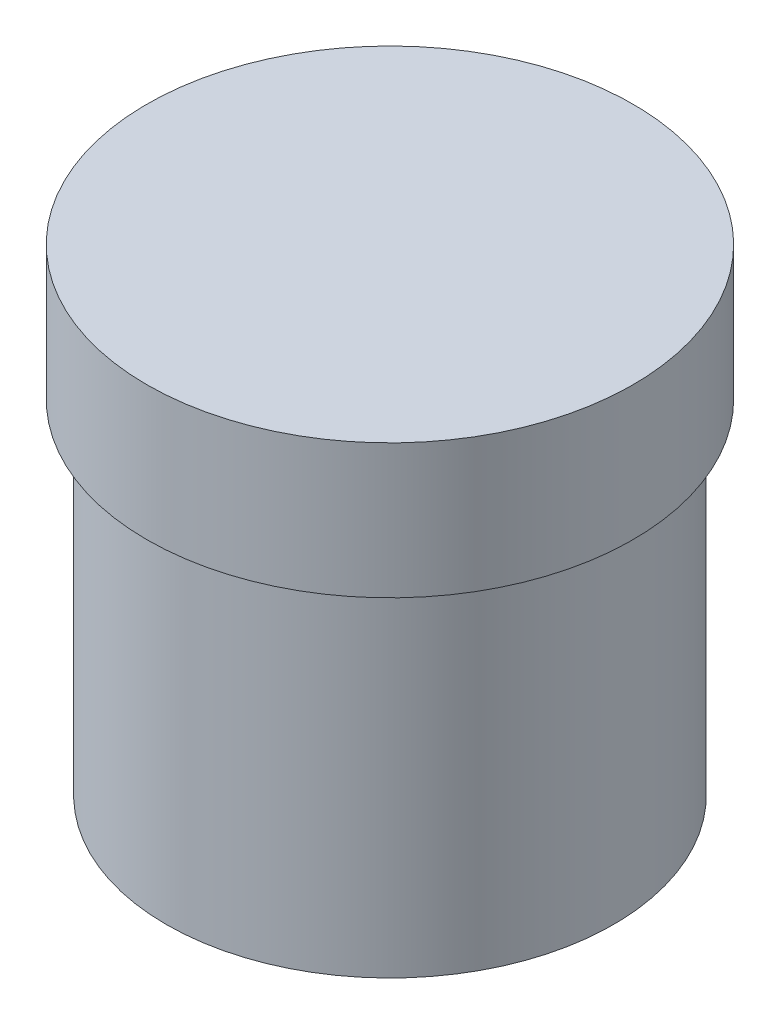
from build123d import *

# Parameters (mm, degrees)
SKETCH_1_R        = 16.3
EXTRUDE_190_DEPTH = 9
SKETCH_2_R        = 15
EXTRUDE_2_DEPTH   = 23


with BuildPart() as part:
    # 草图1 → Extrude 190 (new body)
    with BuildSketch(Plane(origin=(0, 0, 0), x_dir=(1, 0, 0), z_dir=(0, 1, 0))):
        with Locations(Location((0, 0, 0), (0, 0, 270))):
            Circle(SKETCH_1_R)
    extrude(amount=EXTRUDE_190_DEPTH)

    # 草图2 → 凸台-拉伸2 (add)
    with BuildSketch(Plane(origin=(0, 0, 0), x_dir=(1, 0, 0), z_dir=(0, 1, 0))):
        with Locations(Location((0, 0, 0), (0, 0, 270))):
            Circle(SKETCH_2_R)
    extrude(amount=-EXTRUDE_2_DEPTH)


solid = part.part
